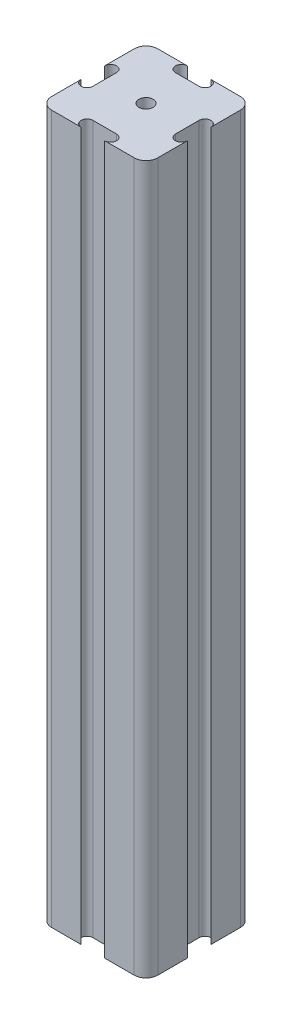
from build123d import *

# Parameters (mm, degrees)
BOSS_EXTRU_2_DEPTH      = 300
ESQUISSE5_R             = 3
ENL_V_MAT_EXTRU_1_DEPTH = 302.682780417


with BuildPart() as part:
    # Esquisse4 → Boss.-Extru.2 (new body)
    with BuildSketch(Plane(origin=(0, 0, 0), x_dir=(1, 0, 0), z_dir=(0, 1, 0))):
        with BuildLine():
            Line((-17.5, 22.5), (-5, 22.5))
            ThreePointArc((-5, 22.5), (-7.5, 20), (-5, 17.5))
            Line((-5, 17.5), (5, 17.5))
            ThreePointArc((5, 17.5), (7.5, 20), (5, 22.5))
            Line((5, 22.5), (17.5, 22.5))
            ThreePointArc((17.5, 22.5), (21.035534799, 21.035533013), (22.5, 17.499997475))
            Line((22.5, 17.499997475), (22.5, 4.999997475))
            ThreePointArc((22.5, 4.999997475), (20, 7.499997475), (17.5, 4.999997475))
            Line((17.5, 4.999997475), (17.5, -5.000002525))
            ThreePointArc((17.5, -5.000002525), (20, -7.500002525), (22.5, -5.000002525))
            Line((22.5, -5.000002525), (22.5, -17.500002525))
            ThreePointArc((22.5, -17.500002525), (21.035533013, -21.035534799), (17.5, -22.5))
            Line((17.5, -22.5), (5, -22.5))
            ThreePointArc((5, -22.5), (7.5, -20), (5, -17.5))
            Line((5, -17.5), (-5, -17.5))
            ThreePointArc((-5, -17.5), (-7.5, -20), (-5, -22.5))
            Line((-5, -22.5), (-17.5, -22.5))
            ThreePointArc((-17.5, -22.5), (-21.035533906, -21.035533906), (-22.5, -17.5))
            Line((-22.5, -17.5), (-22.5, -5))
            ThreePointArc((-22.5, -5), (-20, -7.5), (-17.5, -5))
            Line((-17.5, -5), (-17.5, 5))
            ThreePointArc((-17.5, 5), (-20, 7.5), (-22.5, 5))
            Line((-22.5, 5), (-22.5, 17.5))
            ThreePointArc((-22.5, 17.5), (-21.035533906, 21.035533906), (-17.5, 22.5))
        make_face()
    extrude(amount=BOSS_EXTRU_2_DEPTH)

    # Esquisse5 → Enlèv. mat.-Extru.1 (cut, through all)
    with BuildSketch(Plane.XZ):
        with Locations(Location((0, 0, 0), (0, 0, 270))):
            Circle(ESQUISSE5_R)
    extrude(amount=-ENL_V_MAT_EXTRU_1_DEPTH, mode=Mode.SUBTRACT)


solid = part.part
